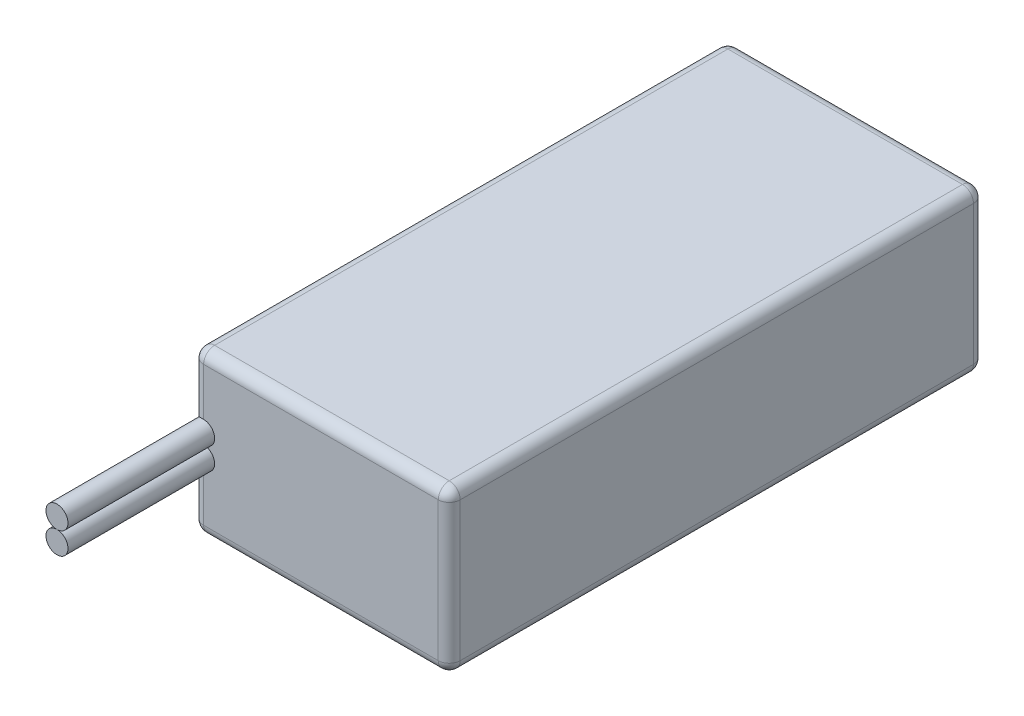
from build123d import *

# Parameters (mm, degrees)
SKETCH1_W                = 35
SKETCH1_H                = 73
BOSS_EXTRUDE1_DEPTH      = 22
FILLET1_R                = 1.5
BOSS_EXTRUDE5_DEPTH      = 20
BOSS_EXTRUDE5_DEPTH_BACK = 5


with BuildPart() as part:
    # Sketch1 → Boss-Extrude1 (new body)
    with BuildSketch(Plane(origin=(0, 0, 0), x_dir=(1, 0, 0), z_dir=(0, 1, 0))):
        Rectangle(SKETCH1_W, SKETCH1_H)
    extrude(amount=BOSS_EXTRUDE1_DEPTH)

    # Fillet1
    fillet1_edges = [part.edges().sort_by_distance(p)[0] for p in [
        (-17.5, 22, 0),
        (0, 22, 36.5),
        (17.5, 22, 0),
        (0, 0, 36.5),
        (-17.5, 0, 0),
        (0, 0, -36.5),
        (17.5, 0, 0),
        (17.5, 11, 36.5),
        (-17.5, 11, 36.5),
        (-17.5, 11, -36.5),
        (17.5, 11, -36.5),
        (0, 22, -36.5),
    ]]
    fillet(fillet1_edges, radius=FILLET1_R)


with BuildPart() as body_2:
    # Sketch2 → Boss-Extrude5 (new, two sides: drawn at the far end of the back side and taken through both)
    with BuildSketch(Plane.XY.offset(36.5).offset(-BOSS_EXTRUDE5_DEPTH_BACK)):
        with BuildLine():
            ThreePointArc((-16, 11), (-14.939339828, 11.439339828), (-14.5, 12.5))
            ThreePointArc((-14.5, 12.5), (-14.939339828, 13.560660172), (-16, 14))
            Line((-16, 14), (-16, 11))
        make_face()
        with BuildLine():
            Line((-16, 11), (-16, 14))
            ThreePointArc((-16, 14), (-17.5, 12.5), (-16, 11))
        make_face()
        with BuildLine():
            ThreePointArc((-14.5, 9.5), (-14.939339828, 10.560660172), (-16, 11))
            Line((-16, 11), (-16, 8))
            ThreePointArc((-16, 8), (-14.939339828, 8.439339828), (-14.5, 9.5))
        make_face()
        with BuildLine():
            Line((-16, 8), (-16, 11))
            ThreePointArc((-16, 11), (-17.5, 9.5), (-16, 8))
        make_face()
    extrude(amount=BOSS_EXTRUDE5_DEPTH + BOSS_EXTRUDE5_DEPTH_BACK)


solid = Compound([part.part, body_2.part])
